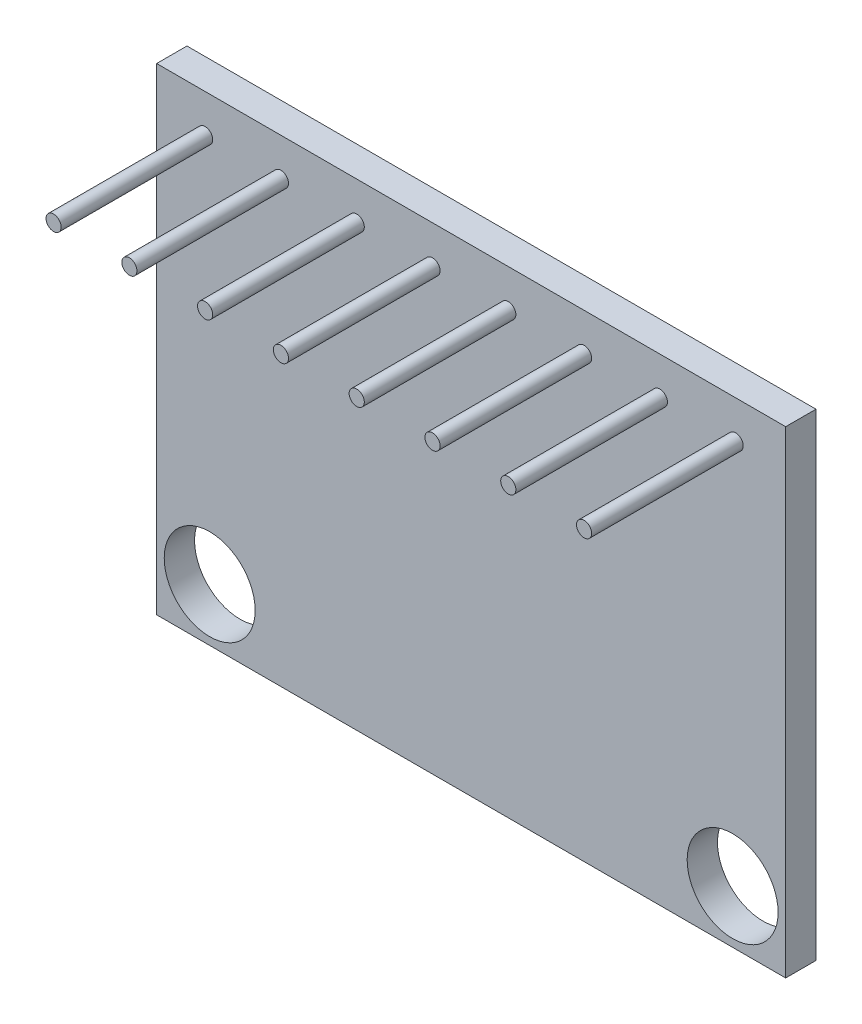
from build123d import *

# Parameters (mm, degrees)
ESQUISSE1_W             = 20.75
ESQUISSE1_H             = 15.75
BOSS_EXTRU_1_DEPTH      = 1
ESQUISSE4_W             = 0.5
ESQUISSE4_H             = 2
ESQUISSE4_H_2           = 1
ESQUISSE4_W_2           = 2.5
ESQUISSE4_W_3           = 4
ESQUISSE4_H_3           = 4
BOSS_EXTRU_4_DEPTH      = 0.5
ESQUISSE5_R             = 1.5
ENL_V_MAT_EXTRU_1_DEPTH = 5
ESQUISSE6_W             = 2.5
ESQUISSE6_H             = 2
BOSS_EXTRU_5_DEPTH      = 0.5
BOSS_EXTRU_6_DEPTH      = 5
BOSS_EXTRU_6_DEPTH_BACK = 1.5
ESQUISSE7_R             = 0.25


with BuildPart() as part:
    # Esquisse1 → Boss.-Extru.1 (new body)
    with BuildSketch(Plane.XY):
        with Locations((-10.375, 7.875)):
            Rectangle(ESQUISSE1_W, ESQUISSE1_H)
    extrude(amount=BOSS_EXTRU_1_DEPTH)

    # Esquisse4 → Boss.-Extru.4 (add)
    with BuildSketch(Plane(origin=(0, 0, 0), x_dir=(-1, 0, 0), z_dir=(0, 0, -1))):
        with Locations((6.625, 8.875)):
            Rectangle(ESQUISSE4_W, ESQUISSE4_H)
        with Locations((5.625, 9.375)):
            Rectangle(ESQUISSE4_W, ESQUISSE4_H_2)
        with Locations((4.625, 8.875)):
            Rectangle(ESQUISSE4_W, ESQUISSE4_H)
        with Locations((4.625, 6.375)):
            Rectangle(ESQUISSE4_W, ESQUISSE4_H_2)
        with Locations((6.625, 5.875)):
            Rectangle(ESQUISSE4_W, ESQUISSE4_H)
        with Locations((10.00670855, 3.574144423)):
            Rectangle(ESQUISSE4_W_2, ESQUISSE4_H_2)
        with Locations((10.375, 7.875)):
            Rectangle(ESQUISSE4_W_3, ESQUISSE4_H_3)
        with Locations((14.125, 8.875)):
            Rectangle(ESQUISSE4_W, ESQUISSE4_H)
        with Locations((16.125, 8.875)):
            Rectangle(ESQUISSE4_W, ESQUISSE4_H)
        with Locations((15.125, 9.375)):
            Rectangle(ESQUISSE4_W, ESQUISSE4_H_2)
        with Locations((14.125, 6.375)):
            Rectangle(ESQUISSE4_W, ESQUISSE4_H_2)
        with Locations((16.125, 5.875)):
            Rectangle(ESQUISSE4_W, ESQUISSE4_H)
    extrude(amount=BOSS_EXTRU_4_DEPTH)

    # Esquisse5 → Enlèv. mat.-Extru.1 (cut)
    with BuildSketch(Plane(origin=(0, 0, 0), x_dir=(-1, 0, 0), z_dir=(0, 0, -1))):
        with Locations((1.75, 1.75)):
            Circle(ESQUISSE5_R)
        with Locations((19, 1.75)):
            Circle(ESQUISSE5_R)
    extrude(amount=-ENL_V_MAT_EXTRU_1_DEPTH, mode=Mode.SUBTRACT)

    # Esquisse6 → Boss.-Extru.5 (add)
    with BuildSketch(Plane(origin=(0, 0, 0), x_dir=(-1, 0, 0), z_dir=(0, 0, -1))):
        with Locations((19, 8.875)):
            Rectangle(ESQUISSE6_W, ESQUISSE6_H)
    extrude(amount=BOSS_EXTRU_5_DEPTH)

    # Esquisse7 → Boss.-Extru.6 (add, two sides: drawn at the far end of the back side and taken through both)
    with BuildSketch(Plane.XY.offset(1).offset(-BOSS_EXTRU_6_DEPTH_BACK)):
        with Locations((-19.15, 14.5)):
            Circle(ESQUISSE7_R)
        with Locations((-16.65, 14.5)):
            Circle(ESQUISSE7_R)
        with Locations((-14.15, 14.5)):
            Circle(ESQUISSE7_R)
        with Locations((-11.65, 14.5)):
            Circle(ESQUISSE7_R)
        with Locations((-9.15, 14.5)):
            Circle(ESQUISSE7_R)
        with Locations((-6.65, 14.5)):
            Circle(ESQUISSE7_R)
        with Locations((-4.15, 14.5)):
            Circle(ESQUISSE7_R)
        with Locations((-1.65, 14.5)):
            Circle(ESQUISSE7_R)
    extrude(amount=BOSS_EXTRU_6_DEPTH + BOSS_EXTRU_6_DEPTH_BACK)


solid = part.part
